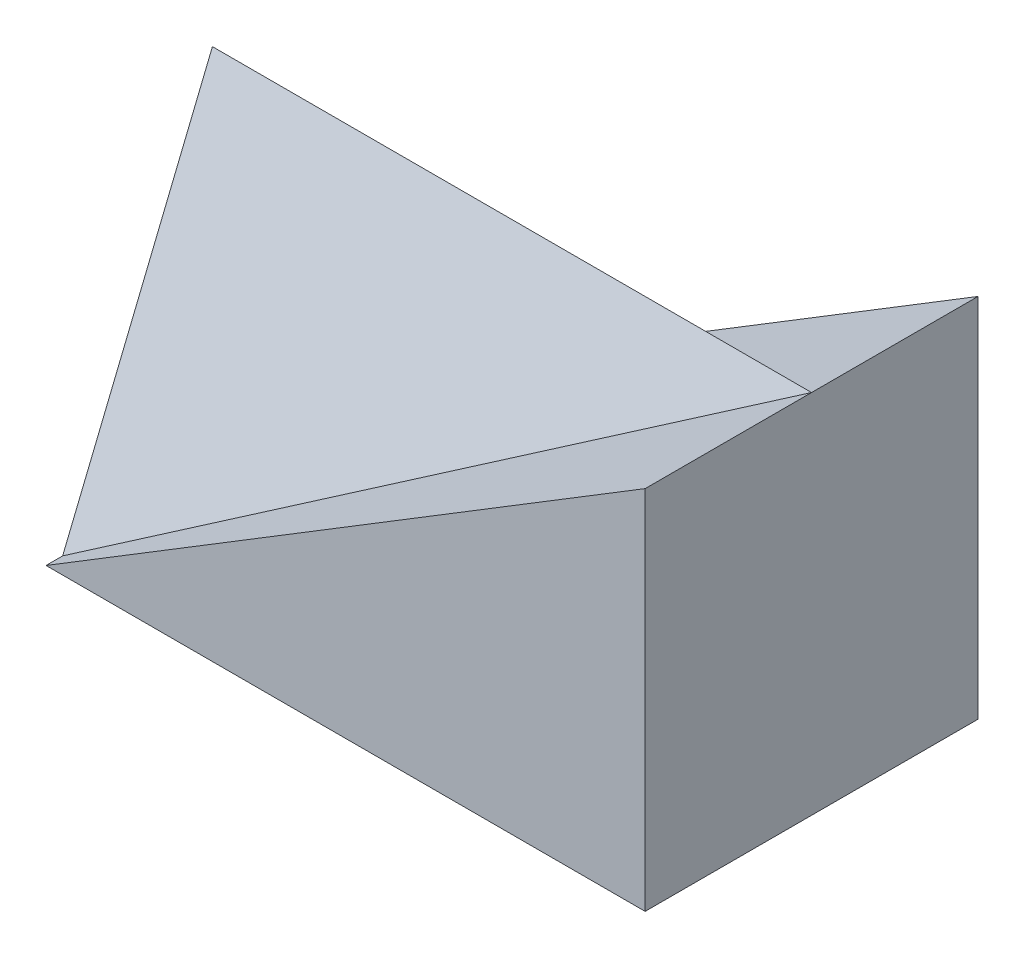
from build123d import *

# Parameters (mm, degrees)
BOSS_EXTRUDE1_DEPTH = 20000
BOSS_EXTRUDE3_DEPTH = 36000


with BuildPart() as part:
    # Sketch1 → Boss-Extrude1 (new body)
    with BuildSketch(Plane.XY):
        Polygon((0, 0), (36000, 0), (36000, 22000), align=None)
    extrude(amount=BOSS_EXTRUDE1_DEPTH)

    # Sketch3 → Boss-Extrude3 (add)
    with BuildSketch(Plane(origin=(36000, 0, 0), x_dir=(0, 0, -1), z_dir=(1, 0, 0))):
        Polygon((-10000, 22000), (-19000, 0), (-1000, 0), align=None)
    extrude(amount=-BOSS_EXTRUDE3_DEPTH)


solid = part.part
